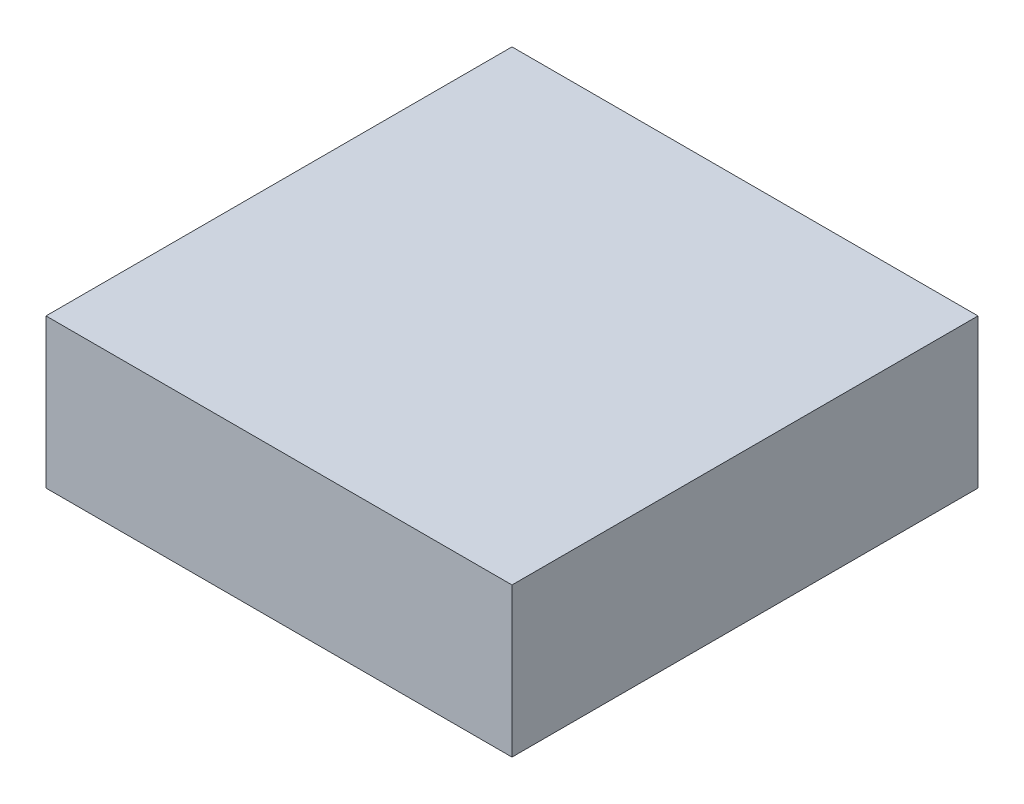
from build123d import *

# Parameters (mm, degrees)
SKETCH1_W           = 12.7
SKETCH1_H           = 12.7
BOSS_EXTRUDE1_DEPTH = 4.064


with BuildPart() as part:
    # Sketch1 → Boss-Extrude1 (new body)
    with BuildSketch(Plane(origin=(0, 0, 0), x_dir=(1, 0, 0), z_dir=(0, 1, 0))):
        Rectangle(SKETCH1_W, SKETCH1_H)
    extrude(amount=BOSS_EXTRUDE1_DEPTH)


solid = part.part
